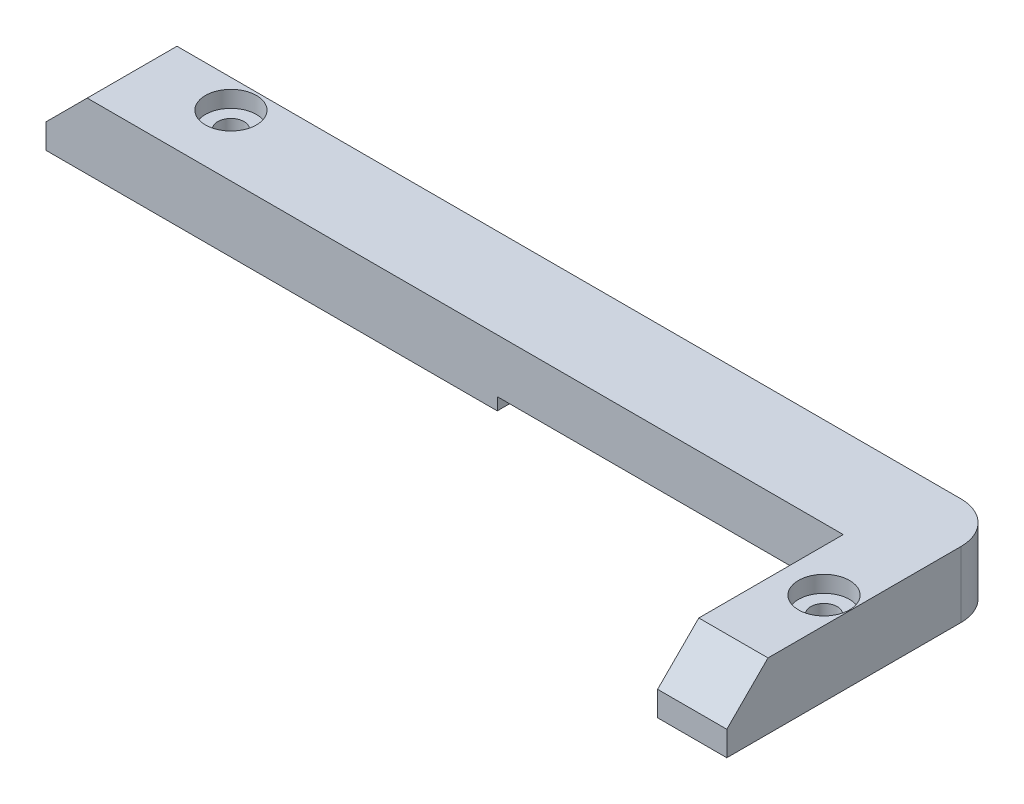
from build123d import *

# Parameters (mm, degrees)
SKETCH_1_W              = 337.35
SKETCH_1_H              = 116.87
SKETCH_1_W_2            = 324.05
SKETCH_1_H_2            = 103.07
EXTRUDE_1_DEPTH         = 8
FILLET_1_R              = 5
HOLE_WIZARD_3_2_3_2_1_D = 3.2
SKETCH_5_W              = 32
SKETCH_5_H              = 1.5
CUT_EXTRUDE_1_DEPTH     = 355.911853
EXTRUDE_2_REACH         = 356.912
SKETCH_6_W              = 3
SKETCH_6_H              = 8
SKETCH_7_W              = 257.05
SKETCH_7_H              = 8
EXTRUDE_3_DEPTH         = 4
SKETCH_8_W              = 257.05
SKETCH_8_H              = 4
EXTRUDE_4_DEPTH         = 3
SKETCH_11_W             = 99.07
SKETCH_11_H             = 11
EXTRUDE_5_DEPTH         = 2
SKETCH_13_W             = 42
SKETCH_13_H             = 4.5
CUT_EXTRUDE_2_DEPTH     = 354.692894189
SKETCH_14_W             = 121.5
SKETCH_14_H             = 1.5
CUT_EXTRUDE_3_DEPTH     = 355.911853
SKETCH_16_W             = 32
SKETCH_16_H             = 6.5
EXTRUDE_7_DEPTH         = 4
SKETCH_17_W             = 103.07
SKETCH_17_H             = 3
CUT_EXTRUDE_4_DEPTH     = 0.1
EXTRUDE_8_DEPTH         = 2
SKETCH_19_W             = 70.55
SKETCH_19_H             = 2
SKETCH_19_W_2           = 95
EXTRUDE_9_DEPTH         = 3
SKETCH_20_R             = 3.5
CUT_EXTRUDE_5_DEPTH     = 4
SKETCH_21_R             = 3.1
CUT_EXTRUDE_6_DEPTH     = 2
EXTRUDE_10_DEPTH        = 2
EXTRUDE_10_DEPTH_BACK   = 3
SKETCH_22_W             = 6
SKETCH_22_H             = 6
SKETCH_22_R             = 1.5
SKETCH_23_W             = 10
SKETCH_23_H             = 1.5
SKETCH_23_W_2           = 15
CUT_EXTRUDE_7_DEPTH     = 6.9
SKETCH_24_W             = 103.07
SKETCH_24_H             = 3
CUT_EXTRUDE_8_DEPTH     = 358.110094229
SKETCH_25_W             = 466.496248886
SKETCH_25_H             = 203.631856069
SKETCH_25_W_2           = 113.515173444
SKETCH_25_H_2           = 34.550681359
CUT_EXTRUDE_9_DEPTH     = 358.110094229
CHAMFER_1_SIZE          = 5


with BuildPart() as part:
    # 草图1 → 凸台-拉伸1 (new body)
    with BuildSketch(Plane(origin=(0, 0, 0), x_dir=(1, 0, 0), z_dir=(0, 1, 0))):
        with Locations((168.675, 58.435)):
            Rectangle(SKETCH_1_W, SKETCH_1_H)
        with Locations((168.925, 58.435)):
            Rectangle(SKETCH_1_W_2, SKETCH_1_H_2, mode=Mode.SUBTRACT)
    extrude(amount=EXTRUDE_1_DEPTH)

    # 圆角1
    fillet_1_edges = [part.edges().sort_by_distance(p)[0] for p in [
        (0, 4, -116.87),
        (337.35, 4, -116.87),
        (337.35, 4, 0),
        (0, 4, 0),
    ]]
    fillet(fillet_1_edges, radius=FILLET_1_R)

    # Ø3.2 (3.2) 直径孔1 (through all)
    with Locations(Plane(origin=(0, 8, 0), x_dir=(1, 0, 0), z_dir=(0, 1, 0))):
        with Locations((3.45, 98.435), (87.17, 113.42), (247.17, 113.42), (334.15, 98.435), (334.15, 18.435), (247.17, 3.45), (87.17, 3.45), (3.45, 18.435)):
            Hole(HOLE_WIZARD_3_2_3_2_1_D / 2)

    # 草图5 → 切除-拉伸1 (cut, through all)
    with BuildSketch(Plane.XY.offset(-109.97)):
        with Locations((57.9, 0.75)):
            Rectangle(SKETCH_5_W, SKETCH_5_H)
    extrude(amount=-CUT_EXTRUDE_1_DEPTH, mode=Mode.SUBTRACT)

    # 草图6 → 凸台-拉伸2 (add, up to next)
    with BuildSketch(Plane.XY.offset(-109.97), mode=Mode.PRIVATE) as extrude_2_sk1:
        with Locations((40.4, 4)):
            Rectangle(SKETCH_6_W, SKETCH_6_H)
    extrude_2_tool1 = extrude(extrude_2_sk1.sketch, amount=EXTRUDE_2_REACH, mode=Mode.PRIVATE) - part.part
    add(extrude_2_tool1.solids().sort_by_distance((40.4, 4, -109.97))[0])

    # 草图7 → 凸台-拉伸3 (add)
    with BuildSketch(Plane.XY.offset(-109.97)):
        with Locations((202.425, 4)):
            Rectangle(SKETCH_7_W, SKETCH_7_H)
    extrude(amount=EXTRUDE_3_DEPTH)

    # 草图8 → 凸台-拉伸4 (add)
    with BuildSketch(Plane.XZ):
        with Locations((202.425, -107.97)):
            Rectangle(SKETCH_8_W, SKETCH_8_H)
    extrude(amount=EXTRUDE_4_DEPTH)

    # 草图11 → 凸台-拉伸5 (add)
    with BuildSketch(Plane.ZY.offset(-330.95)):
        with Locations((-56.435, 2.5)):
            Rectangle(SKETCH_11_W, SKETCH_11_H)
    extrude(amount=EXTRUDE_5_DEPTH)

    # 草图13 → 切除-拉伸2 (cut, through all)
    with BuildSketch(Plane.XY.offset(-105.97)):
        with Locations((307.95, -0.75)):
            Rectangle(SKETCH_13_W, SKETCH_13_H)
    extrude(amount=-CUT_EXTRUDE_2_DEPTH, mode=Mode.SUBTRACT)

    # 草图14 → 切除-拉伸3 (cut, through all)
    with BuildSketch(Plane(origin=(0, 0, -6.9), x_dir=(-1, 0, 0), z_dir=(0, 0, -1))):
        with Locations((-173.2, 0.75)):
            Rectangle(SKETCH_14_W, SKETCH_14_H)
    extrude(amount=-CUT_EXTRUDE_3_DEPTH, mode=Mode.SUBTRACT)

    # 草图16 → 凸台-拉伸7 (add)
    with BuildSketch(Plane.XY.offset(-109.97)):
        with Locations((57.9, 4.75)):
            Rectangle(SKETCH_16_W, SKETCH_16_H)
    extrude(amount=EXTRUDE_7_DEPTH)

    # 草图17 → 切除-拉伸4 (cut)
    with BuildSketch(Plane(origin=(330.95, 0, 0), x_dir=(0, 0, -1), z_dir=(1, 0, 0))):
        with Locations((58.435, -1.5)):
            Rectangle(SKETCH_17_W, SKETCH_17_H)
    extrude(amount=-CUT_EXTRUDE_4_DEPTH, mode=Mode.SUBTRACT)

    # 草图18 → 凸台-拉伸8 (add)
    with BuildSketch(Plane(origin=(0, 0, -6.9), x_dir=(-1, 0, 0), z_dir=(0, 0, -1))):
        Polygon((-233.95, 0), (-233.95, 1.5), (-112.45, 1.5), (-112.45, 0), (-41.9, 0), (-41.9, 8), (-328.95, 8), (-328.95, 0), align=None)
    extrude(amount=EXTRUDE_8_DEPTH)

    # 草图19 → 凸台-拉伸9 (add)
    with BuildSketch(Plane.XZ):
        with Locations((77.175, -7.9)):
            Rectangle(SKETCH_19_W, SKETCH_19_H)
        with Locations((281.45, -7.9)):
            Rectangle(SKETCH_19_W_2, SKETCH_19_H)
    extrude(amount=EXTRUDE_9_DEPTH)

    # 草图20 → 切除-拉伸5 (cut)
    with BuildSketch(Plane.XZ.offset(3)):
        with Locations((92.088456012, -9.54)):
            Circle(SKETCH_20_R)
        with Locations((262.268456012, -9.54)):
            Circle(SKETCH_20_R)
        with Locations((328.308456012, -13.35)):
            Circle(SKETCH_20_R)
        with Locations((328.308456012, -74.31)):
            Circle(SKETCH_20_R)
        with Locations((137.808456012, -107.33)):
            Circle(SKETCH_20_R)
        with Locations((22.238456012, -9.54)):
            Circle(SKETCH_20_R)
        with Locations((9.538456012, -23.51)):
            Circle(SKETCH_20_R)
        with Locations((9.538456012, -103.52)):
            Circle(SKETCH_20_R)
    extrude(amount=-CUT_EXTRUDE_5_DEPTH, mode=Mode.SUBTRACT)

    # 草图21 → 切除-拉伸6 (cut)
    with BuildSketch(Plane(origin=(0, 8, 0), x_dir=(1, 0, 0), z_dir=(0, 1, 0))):
        with Locations(Location((87.17, 113.42, 0), (0, 0, 270))):
            Circle(SKETCH_21_R)
        with Locations(Location((247.17, 113.42, 0), (0, 0, 270))):
            Circle(SKETCH_21_R)
        with Locations(Location((334.15, 98.435, 0), (0, 0, 270))):
            Circle(SKETCH_21_R)
        with Locations(Location((334.15, 18.435, 0), (0, 0, 270))):
            Circle(SKETCH_21_R)
        with Locations(Location((247.17, 3.45, 0), (0, 0, 270))):
            Circle(SKETCH_21_R)
        with Locations(Location((87.17, 3.45, 0), (0, 0, 270))):
            Circle(SKETCH_21_R)
        with Locations(Location((3.45, 18.435, 0), (0, 0, 270))):
            Circle(SKETCH_21_R)
        with Locations(Location((3.45, 98.435, 0), (0, 0, 270))):
            Circle(SKETCH_21_R)
    extrude(amount=-CUT_EXTRUDE_6_DEPTH, mode=Mode.SUBTRACT)

    # 草图22 → 凸台-拉伸10 (add, two sides: drawn at the far end of the back side and taken through both)
    # profile 1 of 4: a face of its own
    with BuildSketch(Plane(origin=(0, 4, 0), x_dir=(1, 0, 0), z_dir=(0, 1, 0)).offset(-EXTRUDE_10_DEPTH_BACK)):
        with Locations((9.9, 106.97)):
            Rectangle(SKETCH_22_W, SKETCH_22_H)
        with Locations(Location((9.9, 106.97, 0), (0, 0, 90))):
            Circle(SKETCH_22_R, mode=Mode.SUBTRACT)
    # profile 2 of 4: a face of its own
    with BuildSketch(Plane(origin=(0, 4, 0), x_dir=(1, 0, 0), z_dir=(0, 1, 0)).offset(-EXTRUDE_10_DEPTH_BACK)):
        with Locations((35.9, 106.97)):
            Rectangle(SKETCH_22_W, SKETCH_22_H)
        with Locations(Location((35.9, 106.97, 0), (0, 0, 90))):
            Circle(SKETCH_22_R, mode=Mode.SUBTRACT)
    # profile 3 of 4: a face of its own
    with BuildSketch(Plane(origin=(0, 4, 0), x_dir=(1, 0, 0), z_dir=(0, 1, 0)).offset(-EXTRUDE_10_DEPTH_BACK)):
        with Locations((9.9, 9.9)):
            Rectangle(SKETCH_22_W, SKETCH_22_H)
        with Locations(Location((9.9, 9.9, 0), (0, 0, 90))):
            Circle(SKETCH_22_R, mode=Mode.SUBTRACT)
    # profile 4 of 4: a face of its own
    with BuildSketch(Plane(origin=(0, 4, 0), x_dir=(1, 0, 0), z_dir=(0, 1, 0)).offset(-EXTRUDE_10_DEPTH_BACK)):
        with Locations((35.9, 9.9)):
            Rectangle(SKETCH_22_W, SKETCH_22_H)
        with Locations(Location((35.9, 9.9, 0), (0, 0, 90))):
            Circle(SKETCH_22_R, mode=Mode.SUBTRACT)
    extrude(amount=EXTRUDE_10_DEPTH + EXTRUDE_10_DEPTH_BACK)

    # 草图23 → 切除-拉伸7 (cut)
    with BuildSketch(Plane.ZY):
        with Locations((-63.435, 0.75)):
            Rectangle(SKETCH_23_W, SKETCH_23_H)
        with Locations((-50.935, 0.75)):
            Rectangle(SKETCH_23_W_2, SKETCH_23_H)
    extrude(amount=-CUT_EXTRUDE_7_DEPTH, mode=Mode.SUBTRACT)

    # 草图24 → 切除-拉伸8 (cut, through all)
    with BuildSketch(Plane(origin=(337.35, 0, 0), x_dir=(0, 0, -1), z_dir=(1, 0, 0))):
        with Locations((58.435, -1.5)):
            Rectangle(SKETCH_24_W, SKETCH_24_H)
    extrude(amount=-CUT_EXTRUDE_8_DEPTH, mode=Mode.SUBTRACT)

    # 草图25 → 切除-拉伸9 (cut, through all)
    with BuildSketch(Plane(origin=(0, 8, 0), x_dir=(1, 0, 0), z_dir=(0, 1, 0))):
        with Locations((204.544170856, 58.459603301)):
            Rectangle(SKETCH_25_W, SKETCH_25_H)
        with Locations((288.927586722, 100.71034068)):
            Rectangle(SKETCH_25_W_2, SKETCH_25_H_2, mode=Mode.SUBTRACT)
    extrude(amount=-CUT_EXTRUDE_9_DEPTH, mode=Mode.SUBTRACT)

    # 倒角1
    chamfer_1_edges = [part.edges().sort_by_distance(p)[0] for p in [
        (333.15, 8, -83.435),
        (232.17, 8, -111.42),
    ]]
    chamfer(chamfer_1_edges, length=CHAMFER_1_SIZE)


solid = part.part
